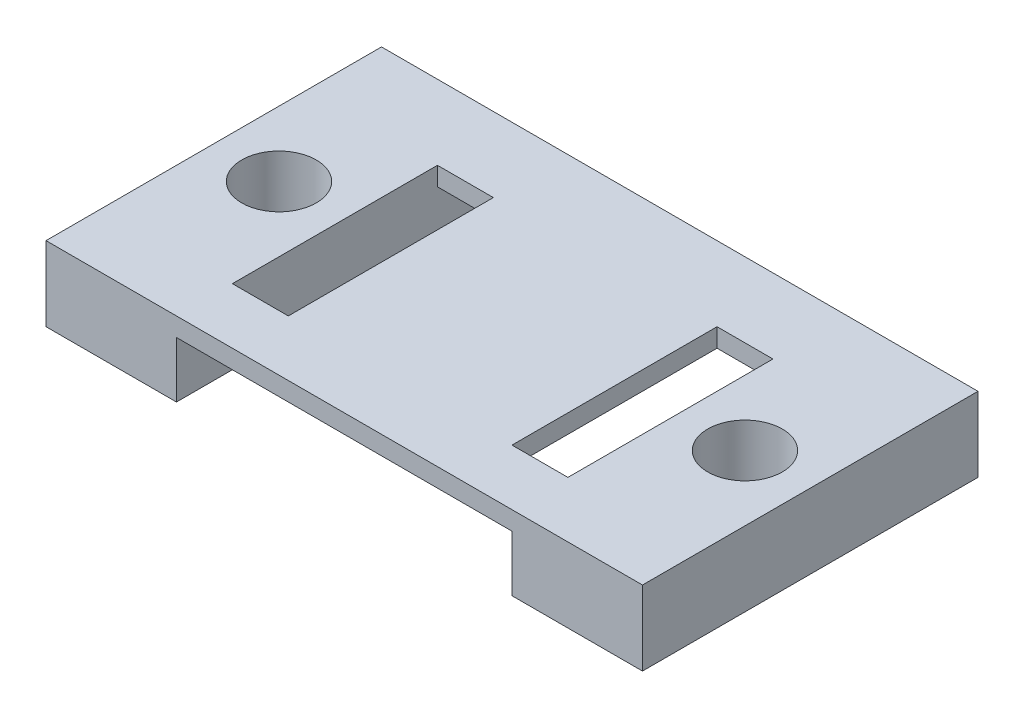
from build123d import *

# Parameters (mm, degrees)
BOSS_EXTRUDE1_DEPTH = 1
SKETCH2_W           = 7
SKETCH2_H           = 18
SKETCH2_R           = 2
BOSS_EXTRUDE2_DEPTH = 4


with BuildPart() as part:
    # Sketch1 → Boss-Extrude1 (new body)
    with BuildSketch(Plane(origin=(0, 0, 0), x_dir=(1, 0, 0), z_dir=(0, 1, 0))):
        Polygon((-9, 0), (9, 0), (9, 3), (6, 3), (6, 14), (9, 14), (9, 18), (-9, 18), (-9, 14), (-6, 14), (-6, 3), (-9, 3), align=None)
    extrude(amount=BOSS_EXTRUDE1_DEPTH)

    # Sketch2 → Boss-Extrude2 (add)
    # profile 1 of 2: a face of its own
    with BuildSketch(Plane(origin=(0, 1, 0), x_dir=(1, 0, 0), z_dir=(0, 1, 0))):
        with Locations((-12.5, 9)):
            Rectangle(SKETCH2_W, SKETCH2_H)
        with Locations(Location((-12.5, 9, 0), (0, 0, 270))):
            Circle(SKETCH2_R, mode=Mode.SUBTRACT)
    # profile 2 of 2: a face of its own
    with BuildSketch(Plane(origin=(0, 1, 0), x_dir=(1, 0, 0), z_dir=(0, 1, 0))):
        with Locations((12.5, 9)):
            Rectangle(SKETCH2_W, SKETCH2_H)
        with Locations(Location((12.5, 9, 0), (0, 0, 90))):
            Circle(SKETCH2_R, mode=Mode.SUBTRACT)
    extrude(amount=-BOSS_EXTRUDE2_DEPTH)


solid = part.part
